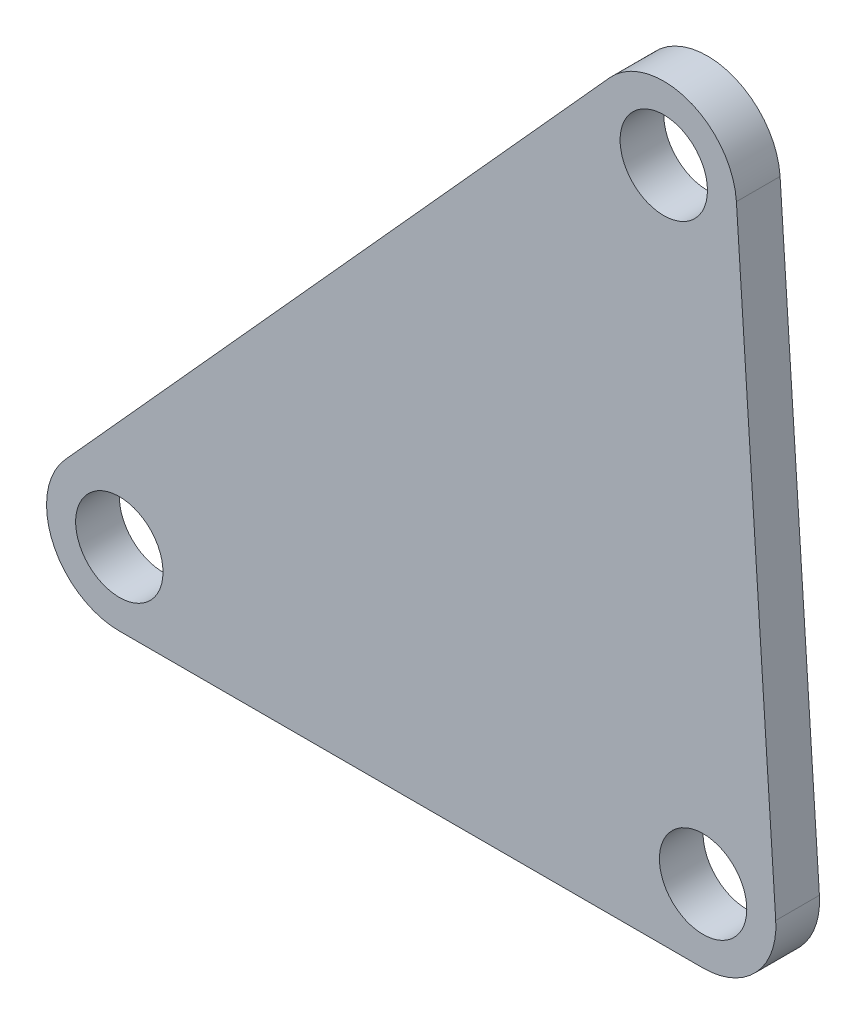
from build123d import *

# Parameters (mm, degrees)
SKETCH_1_R      = 3
EXTRUDE_1_DEPTH = 3
FILLET_1_R      = 5


with BuildPart() as part:
    # ｽｹｯﾁ1 → ﾎﾞｽ - 押し出し1 (new body)
    with BuildSketch(Plane.XY):
        Polygon((1.518334957, 53.544180062), (-51.352653687, -5), (5.336736491, -5), align=None)
        with Locations((-2.700997506, 41.412010486)):
            Circle(SKETCH_1_R, mode=Mode.SUBTRACT)
        with Locations((-40.1, 0)):
            Circle(SKETCH_1_R, mode=Mode.SUBTRACT)
        Circle(SKETCH_1_R, mode=Mode.SUBTRACT)
    extrude(amount=EXTRUDE_1_DEPTH)

    # ﾌｨﾚｯﾄ1
    fillet_1_edges = [part.edges().sort_by_distance(p)[0] for p in [
        (5.336736491, -5, 1.5),
        (-51.352653687, -5, 1.5),
        (1.518334957, 53.544180062, 1.5),
    ]]
    fillet(fillet_1_edges, radius=FILLET_1_R)


solid = part.part
